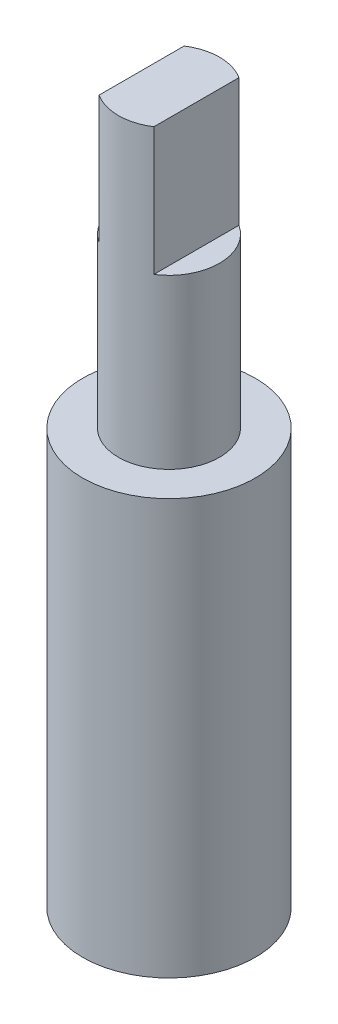
from build123d import *

# Parameters (mm, degrees)
SKETCH1_R           = 3.075
BOSS_EXTRUDE1_DEPTH = 14.77
SKETCH2_R           = 1.8
BOSS_EXTRUDE2_DEPTH = 5.98
BOSS_EXTRUDE3_DEPTH = 4.55
SKETCH4_R           = 2.15
CUT_EXTRUDE1_DEPTH  = 1.95


with BuildPart() as part:
    # Sketch1 → Boss-Extrude1 (new body)
    with BuildSketch(Plane(origin=(0, 0, 0), x_dir=(1, 0, 0), z_dir=(0, 1, 0))):
        with Locations(Location((0, 0, 0), (0, 0, 270))):
            Circle(SKETCH1_R)
    extrude(amount=BOSS_EXTRUDE1_DEPTH)

    # Sketch2 → Boss-Extrude2 (add)
    with BuildSketch(Plane(origin=(0, 14.77, 0), x_dir=(1, 0, 0), z_dir=(0, 1, 0))):
        with Locations(Location((0, 0, 0), (0, 0, 90))):
            Circle(SKETCH2_R)
    extrude(amount=BOSS_EXTRUDE2_DEPTH)

    # Sketch3 → Boss-Extrude3 (add)
    with BuildSketch(Plane(origin=(0, 20.75, 0), x_dir=(1, 0, 0), z_dir=(0, 1, 0))):
        with BuildLine():
            Line((-0.975, 1.513068075), (-0.975, -1.513068075))
            ThreePointArc((-0.975, -1.513068075), (0, -1.8), (0.975, -1.513068075))
            Line((0.975, -1.513068075), (0.975, 1.513068075))
            ThreePointArc((0.975, 1.513068075), (0, 1.8), (-0.975, 1.513068075))
        make_face()
    extrude(amount=BOSS_EXTRUDE3_DEPTH)

    # Sketch4 → Cut-Extrude1 (cut)
    with BuildSketch(Plane.XZ):
        with Locations(Location((0, 0, 0), (0, 0, 270))):
            Circle(SKETCH4_R)
    extrude(amount=-CUT_EXTRUDE1_DEPTH, mode=Mode.SUBTRACT)


solid = part.part
